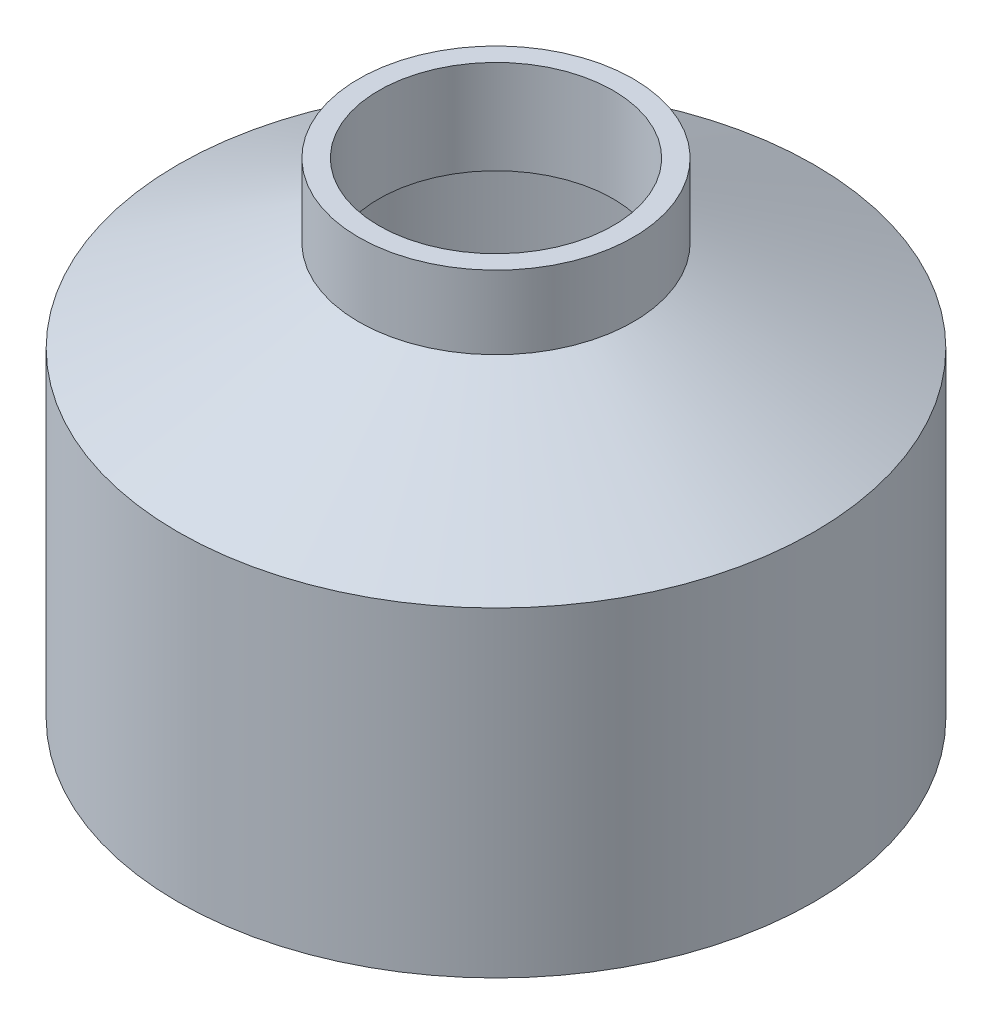
from build123d import *

# Parameters (mm, degrees)
SKETCH_1_R               = 34.75
EXTRUDE_1_DEPTH          = 35
SKETCH_2_R               = 15
EXTRUDE_2_DEPTH          = 8
SHELL_2_T                = -3
CUT_EXTRUDE_1_DEPTH      = 73.278108815
CUT_EXTRUDE_1_DEPTH_BACK = 73.278108815
SKETCH_3_R               = 12.8


with BuildPart() as part:
    # 스케치1 → 보스-돌출1 (new body)
    with BuildSketch(Plane(origin=(0, 0, 0), x_dir=(1, 0, 0), z_dir=(0, 1, 0))):
        with Locations(Location((0, 0, 0), (0, 0, 270))):
            Circle(SKETCH_1_R)
    extrude(amount=EXTRUDE_1_DEPTH)



with BuildPart() as body_2:
    # 스케치2 → 보스-돌출2 (new body)
    with BuildSketch(Plane(origin=(0, 45, 0), x_dir=(1, 0, 0), z_dir=(0, 1, 0))):
        with Locations(Location((0, 0, 0), (0, 0, 270))):
            Circle(SKETCH_2_R)
    extrude(amount=EXTRUDE_2_DEPTH)


with BuildPart() as part_1:
    add(part.part)

    add(body_2.part)  # loft_1 joins it to this body
    # loft from a face of the part (loft_1)
    loft([part_1.faces().sort_by_distance((0, 35, 0))[0], part_1.faces().sort_by_distance((0, 45, 0))[0]])

    # 쉘2
    shell_2_openings = [part_1.faces().sort_by_distance(p)[0] for p in [
        (0, 0, 0),
    ]]
    offset(amount=SHELL_2_T, openings=shell_2_openings, kind=Kind.INTERSECTION)

    # 스케치3 → 컷-돌출1 (cut, two sides: drawn at the far end of the back side and taken through both)
    with BuildSketch(Plane(origin=(0, 53, 0), x_dir=(1, 0, 0), z_dir=(0, 1, 0)).offset(-CUT_EXTRUDE_1_DEPTH_BACK)):
        with Locations(Location((0, 0, 0), (0, 0, 270))):
            Circle(SKETCH_3_R)
    extrude(amount=CUT_EXTRUDE_1_DEPTH + CUT_EXTRUDE_1_DEPTH_BACK, mode=Mode.SUBTRACT)


solid = part_1.part
